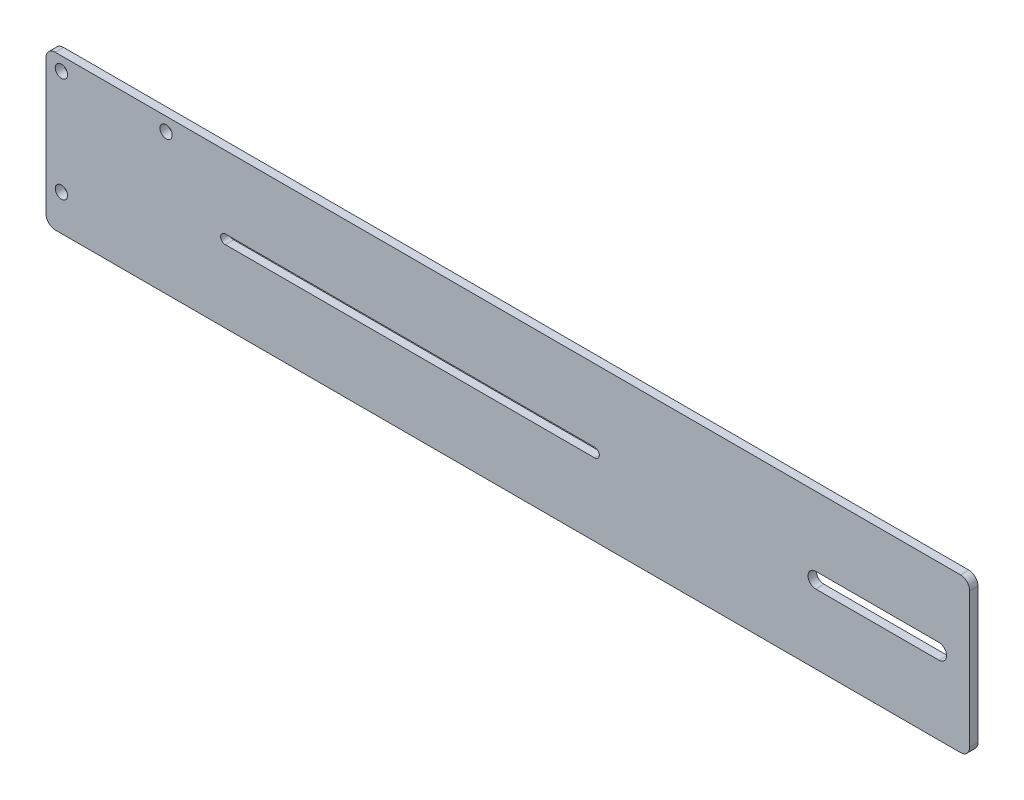
from build123d import *

# Parameters (mm, degrees)
SKETCH_1_R      = 2
EXTRUDE_1_DEPTH = 2.7


with BuildPart() as part:
    # 草图1 → 凸台-拉伸1 (new body)
    with BuildSketch(Plane.XY):
        with BuildLine():
            Line((0, 22), (0, -22))
            ThreePointArc((0, -22), (0.878679656, -24.121320344), (3, -25))
            Line((3, -25), (297, -25))
            ThreePointArc((297, -25), (299.121320344, -24.121320344), (300, -22))
            Line((300, -22), (300, 22))
            ThreePointArc((300, 22), (299.121320344, 24.121320344), (297, 25))
            Line((297, 25), (3, 25))
            ThreePointArc((3, 25), (0.878679656, 24.121320344), (0, 22))
        make_face()
        with Locations(Location((5, 20.65, 0), (0, 0, 180))):
            Circle(SKETCH_1_R, mode=Mode.SUBTRACT)
        with Locations(Location((39, 20.65, 0), (0, 0, 180))):
            Circle(SKETCH_1_R, mode=Mode.SUBTRACT)
        with Locations(Location((5, -13.35, 0), (0, 0, 180))):
            Circle(SKETCH_1_R, mode=Mode.SUBTRACT)
        with BuildLine():
            Line((250, 2.5), (290, 2.5))
            ThreePointArc((290, 2.5), (292.5, 0), (290, -2.5))
            Line((290, -2.5), (250, -2.5))
            ThreePointArc((250, -2.5), (247.5, 0), (250, 2.5))
        make_face(mode=Mode.SUBTRACT)
        with BuildLine():
            Line((58.219392868, 1.5), (178.219392868, 1.5))
            ThreePointArc((178.219392868, 1.5), (179.719392868, 0), (178.219392868, -1.5))
            Line((178.219392868, -1.5), (58.219392868, -1.5))
            ThreePointArc((58.219392868, -1.5), (56.719392868, 0), (58.219392868, 1.5))
        make_face(mode=Mode.SUBTRACT)
    extrude(amount=EXTRUDE_1_DEPTH)


solid = part.part
